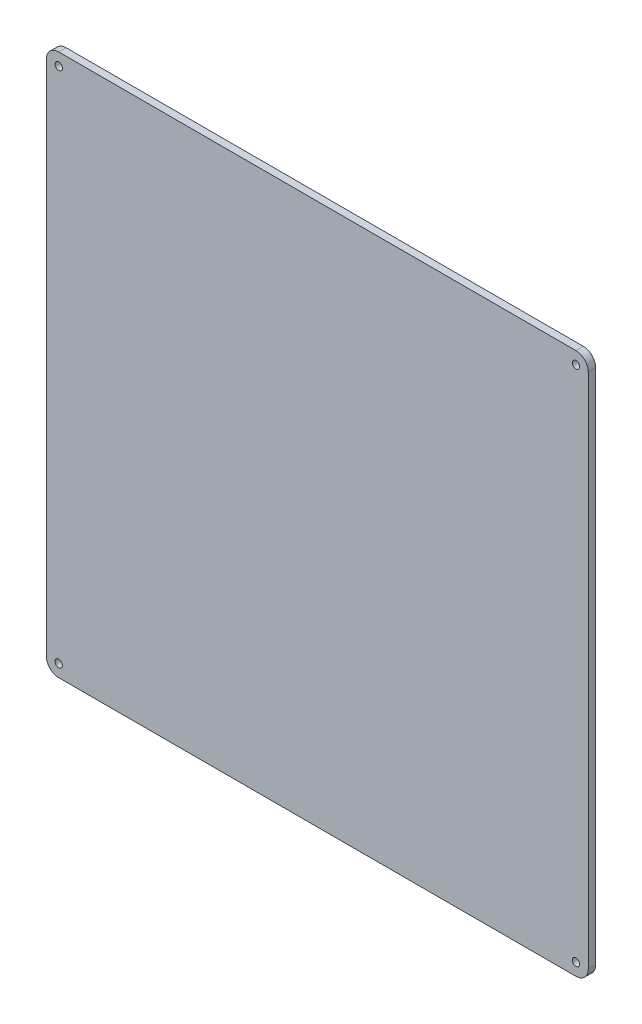
from build123d import *

# Parameters (mm, degrees)
SZKIC1_W                    = 220
SZKIC1_H                    = 220
DODANIE_WYCI_GNI_CIE1_DEPTH = 3
WYTNIJ_WYCI_GNI_CIE2_REACH  = 157.592
SZKIC2_R                    = 1.5
ZAOKR_GLENIE1_R             = 5


with BuildPart() as part:
    # Szkic1 → Dodanie-wyciągnięcie1 (new body)
    with BuildSketch(Plane.XY):
        Rectangle(SZKIC1_W, SZKIC1_H)
    extrude(amount=DODANIE_WYCI_GNI_CIE1_DEPTH)

    # Szkic2 → Wytnij-wyciągnięcie2 (cut, up to next)
    with BuildSketch(Plane(origin=(0, 0, 0), x_dir=(-1, 0, 0), z_dir=(0, 0, -1)), mode=Mode.PRIVATE) as wytnij_wyci_gni_cie2_sk1:
        with Locations((105, -105)):
            Circle(SZKIC2_R)
    wytnij_wyci_gni_cie2_tool1 = extrude(wytnij_wyci_gni_cie2_sk1.sketch, amount=-WYTNIJ_WYCI_GNI_CIE2_REACH, mode=Mode.PRIVATE) & part.part
    # Szkic2 → Wytnij-wyciągnięcie2 (cut, up to next)
    with BuildSketch(Plane(origin=(0, 0, 0), x_dir=(-1, 0, 0), z_dir=(0, 0, -1)), mode=Mode.PRIVATE) as wytnij_wyci_gni_cie2_sk2:
        with Locations((105, 105)):
            Circle(SZKIC2_R)
    wytnij_wyci_gni_cie2_tool2 = extrude(wytnij_wyci_gni_cie2_sk2.sketch, amount=-WYTNIJ_WYCI_GNI_CIE2_REACH, mode=Mode.PRIVATE) & part.part
    # Szkic2 → Wytnij-wyciągnięcie2 (cut, up to next)
    with BuildSketch(Plane(origin=(0, 0, 0), x_dir=(-1, 0, 0), z_dir=(0, 0, -1)), mode=Mode.PRIVATE) as wytnij_wyci_gni_cie2_sk3:
        with Locations((-105, 105)):
            Circle(SZKIC2_R)
    wytnij_wyci_gni_cie2_tool3 = extrude(wytnij_wyci_gni_cie2_sk3.sketch, amount=-WYTNIJ_WYCI_GNI_CIE2_REACH, mode=Mode.PRIVATE) & part.part
    # Szkic2 → Wytnij-wyciągnięcie2 (cut, up to next)
    with BuildSketch(Plane(origin=(0, 0, 0), x_dir=(-1, 0, 0), z_dir=(0, 0, -1)), mode=Mode.PRIVATE) as wytnij_wyci_gni_cie2_sk4:
        with Locations((-105, -105)):
            Circle(SZKIC2_R)
    wytnij_wyci_gni_cie2_tool4 = extrude(wytnij_wyci_gni_cie2_sk4.sketch, amount=-WYTNIJ_WYCI_GNI_CIE2_REACH, mode=Mode.PRIVATE) & part.part
    add(wytnij_wyci_gni_cie2_tool1.solids().sort_by_distance((-105, -105, 0))[0], mode=Mode.SUBTRACT)
    add(wytnij_wyci_gni_cie2_tool2.solids().sort_by_distance((-105, 105, 0))[0], mode=Mode.SUBTRACT)
    add(wytnij_wyci_gni_cie2_tool3.solids().sort_by_distance((105, 105, 0))[0], mode=Mode.SUBTRACT)
    add(wytnij_wyci_gni_cie2_tool4.solids().sort_by_distance((105, -105, 0))[0], mode=Mode.SUBTRACT)

    # Zaokrąglenie1
    zaokr_glenie1_edges = [part.edges().sort_by_distance(p)[0] for p in [
        (110, -110, 1.5),
        (-110, -110, 1.5),
        (-110, 110, 1.5),
        (110, 110, 1.5),
    ]]
    fillet(zaokr_glenie1_edges, radius=ZAOKR_GLENIE1_R)


solid = part.part
